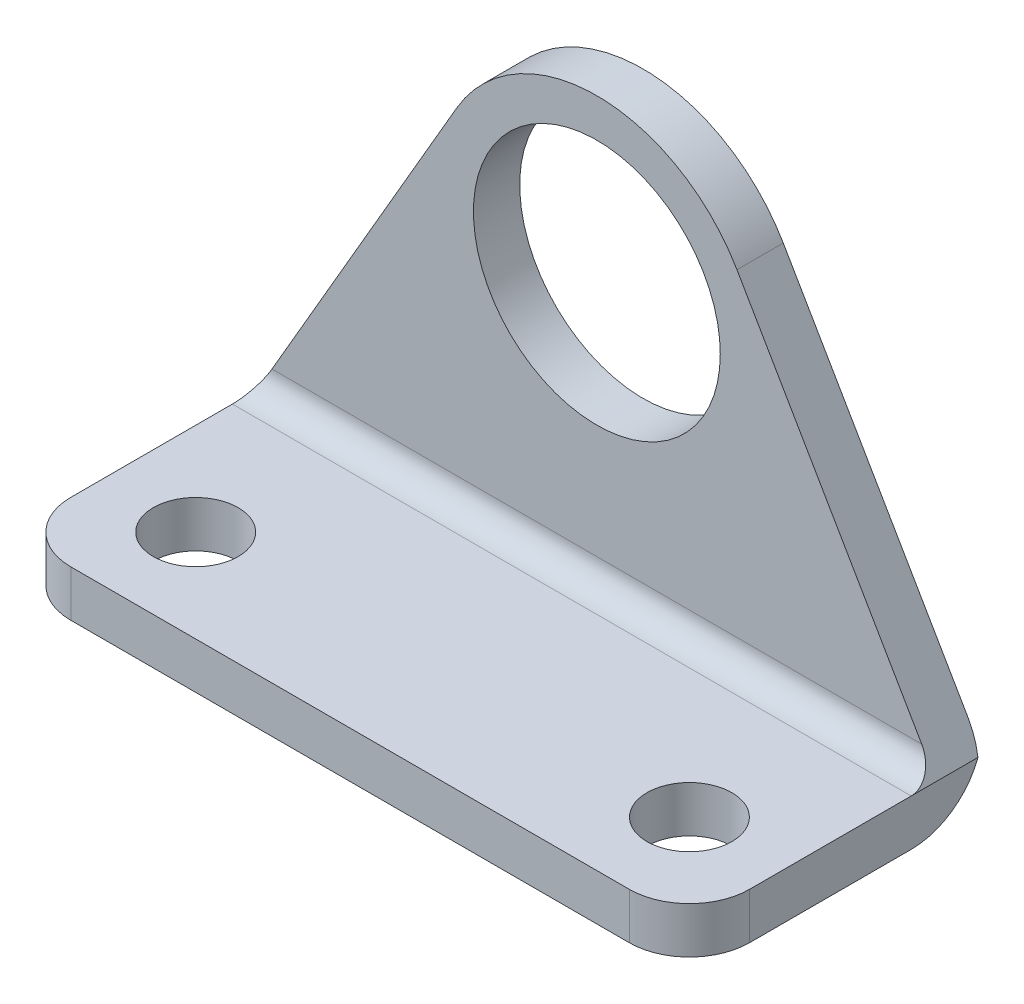
from build123d import *

# Parameters (mm, degrees)
EXTRUDE_START                   = -22
EXTRUDE_1_DEPTH                 = 44
CUT_EXTRUDE_1_DEPTH             = 10
CUT_EXTRUDE_1_DIRECTION_2_REACH = 42.869
SKETCH_6_R                      = 8
CUT_EXTRUDE_2_DEPTH             = 41.868692174
SKETCH_7_R                      = 2.75
CUT_EXTRUDE_3_DEPTH             = 41.015621949
FILLET_1_R                      = 3.9


with BuildPart() as part:
    # 草图4 → 凸台-拉伸1 (new body)
    with BuildSketch(Plane(origin=(0, 0, 0), x_dir=(0, 0, -1), z_dir=(1, 0, 0)).offset(EXTRUDE_START)):
        with BuildLine():
            Line((-19, 0), (-4.625, 0))
            ThreePointArc((-4.625, 0), (-1.354631137, 1.354631137), (0, 4.625))
            Line((0, 4.625), (0, 30.5))
            Line((0, 30.5), (-3, 30.5))
            Line((-3, 30.5), (-3, 4.625))
            ThreePointArc((-3, 4.625), (-3.475951481, 3.475951481), (-4.625, 3))
            Line((-4.625, 3), (-19, 3))
            Line((-19, 3), (-19, 0))
        make_face()
    extrude(amount=EXTRUDE_1_DEPTH)

    # 草图5 → 切除-拉伸1 (cut)
    with BuildSketch(Plane.XY.offset(3)):
        with BuildLine():
            Line((-9.082524892, 25.268561625), (-22, 3))
            Line((-22, 3), (-22, 31.5))
            Line((-22, 31.5), (22, 31.5))
            Line((22, 31.5), (22, 3))
            Line((22, 3), (9.082524892, 25.268561625))
            ThreePointArc((9.082524892, 25.268561625), (0, 30.5), (-9.082524892, 25.268561625))
        make_face()
    extrude(amount=-CUT_EXTRUDE_1_DEPTH, mode=Mode.SUBTRACT)

    # 切除-拉伸1 direction 2: up to this face of the body (flat: up to its plane)
    cut_extrude_1_direction_2_end = Plane(part.part.faces().sort_by_distance((0, 1.5, 19))[0])
    # 草图5 → 切除-拉伸1 direction 2 (cut, up to the picked face)
    with BuildSketch(Plane.XY.offset(3), mode=Mode.PRIVATE) as cut_extrude_1_direction_2_sk1:
        with BuildLine():
            Line((-9.082524892, 25.268561625), (-22, 3))
            Line((-22, 3), (-22, 31.5))
            Line((-22, 31.5), (22, 31.5))
            Line((22, 31.5), (22, 3))
            Line((22, 3), (9.082524892, 25.268561625))
            ThreePointArc((9.082524892, 25.268561625), (0, 30.5), (-9.082524892, 25.268561625))
        make_face()
    cut_extrude_1_direction_2_tool1 = split(extrude(cut_extrude_1_direction_2_sk1.sketch, amount=CUT_EXTRUDE_1_DIRECTION_2_REACH, mode=Mode.PRIVATE), bisect_by=cut_extrude_1_direction_2_end, keep=Keep.BOTH, mode=Mode.PRIVATE)
    add(cut_extrude_1_direction_2_tool1.solids().sort_by(Axis((-15.994729, 14.397326, 3), (0, 0, 1)))[0], mode=Mode.SUBTRACT)

    # 草图6 → 切除-拉伸2 (cut, through all)
    with BuildSketch(Plane.XY.offset(3)):
        with Locations((0, 20)):
            Circle(SKETCH_6_R)
    extrude(amount=-CUT_EXTRUDE_2_DEPTH, mode=Mode.SUBTRACT)

    # 草图7 → 切除-拉伸3 (cut, through all)
    with BuildSketch(Plane(origin=(0, 3, 0), x_dir=(1, 0, 0), z_dir=(0, 1, 0))):
        with Locations(Location((16, -13, 0), (0, 0, 270))):
            Circle(SKETCH_7_R)
        with Locations(Location((-16, -13, 0), (0, 0, 90))):
            Circle(SKETCH_7_R)
    extrude(amount=-CUT_EXTRUDE_3_DEPTH, mode=Mode.SUBTRACT)

    # 圆角1
    fillet_1_edges = [part.edges().sort_by_distance(p)[0] for p in [
        (-22, 1.5, 19),
        (22, 1.5, 19),
    ]]
    fillet(fillet_1_edges, radius=FILLET_1_R)


solid = part.part
